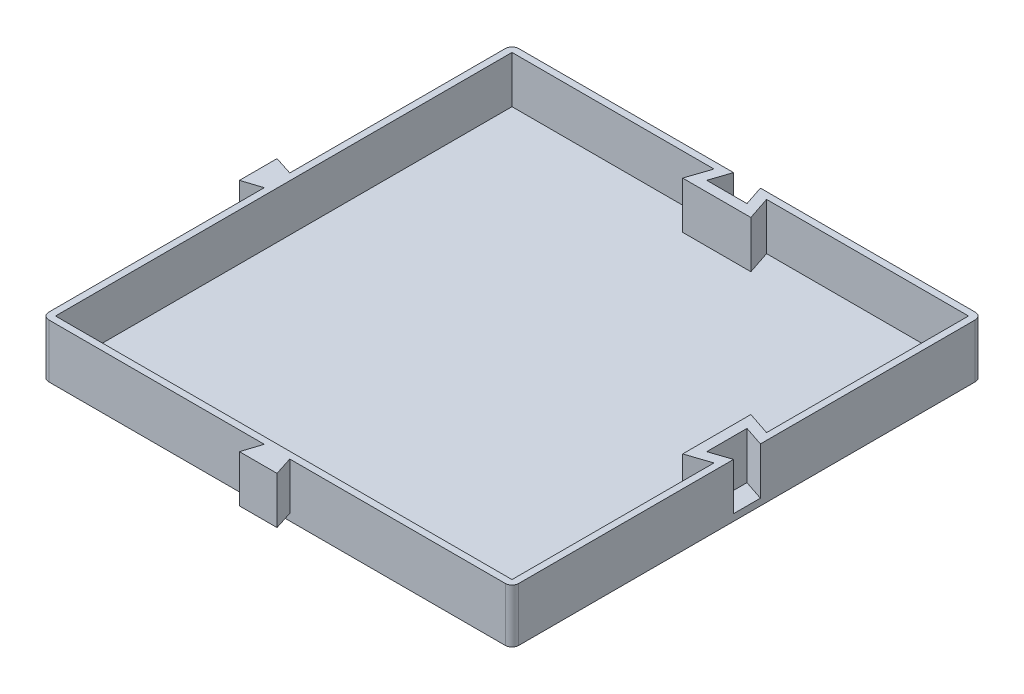
from build123d import *

# Parameters (mm, degrees)
SKETCH1_W               = 88.9
SKETCH1_H               = 88.9
BASE_DRAIN_TRAY_DEPTH   = 10.16
SKETCH2_W               = 86.36
SKETCH2_H               = 86.36
DRAIN_TRAY_CUTOUT_DEPTH = 8.89
SKETCH3_W               = 71.12
SKETCH3_H               = 71.12
BODY_DEPTH              = 50.8
SKETCH4_W               = 68.58
SKETCH4_H               = 68.58
BODY_CUTOUT_DEPTH       = 50.8
FILLET1_R               = 1.27
JOINING_SLOT_DEPTH      = 8.89
JOINING_CUTOUT_DEPTH    = 8.89
JOINING_SLOT_2_DEPTH    = 8.89
JOINING_CUTOUT_2_DEPTH  = 8.89
BOSS_EXTRUDE3_DEPTH     = 8.89
SKETCH14_W              = 71.12
SKETCH14_H              = 71.12
CUT_EXTRUDE2_DEPTH      = 50.8


with BuildPart() as part:
    # Sketch1 → Base/Drain Tray (new body)
    with BuildSketch(Plane(origin=(0, 0, 0), x_dir=(1, 0, 0), z_dir=(0, 1, 0))):
        with Locations((44.45, 44.45)):
            Rectangle(SKETCH1_W, SKETCH1_H)
    extrude(amount=BASE_DRAIN_TRAY_DEPTH)

    # Sketch2 → Drain Tray Cutout (cut)
    with BuildSketch(Plane(origin=(0, 10.16, 0), x_dir=(1, 0, 0), z_dir=(0, 1, 0))):
        with Locations((44.45, 44.45)):
            Rectangle(SKETCH2_W, SKETCH2_H)
    extrude(amount=-DRAIN_TRAY_CUTOUT_DEPTH, mode=Mode.SUBTRACT)

    # Sketch3 → Body (add)
    with BuildSketch(Plane(origin=(0, 1.27, 0), x_dir=(1, 0, 0), z_dir=(0, 1, 0))):
        with Locations((44.45, 44.45)):
            Rectangle(SKETCH3_W, SKETCH3_H)
    extrude(amount=BODY_DEPTH)

    # Sketch4 → Body Cutout (cut)
    with BuildSketch(Plane(origin=(0, 52.07, 0), x_dir=(1, 0, 0), z_dir=(0, 1, 0))):
        with Locations((44.45, 44.45)):
            Rectangle(SKETCH4_W, SKETCH4_H)
    extrude(amount=-BODY_CUTOUT_DEPTH, mode=Mode.SUBTRACT)

    # Fillet1
    fillet1_edges = [part.edges().sort_by_distance(p)[0] for p in [
        (0, 5.08, -88.9),
        (88.9, 5.08, -88.9),
        (88.9, 5.08, 0),
        (0, 5.08, 0),
    ]]
    fillet(fillet1_edges, radius=FILLET1_R)

    # Sketch7 → Joining Slot (add)
    with BuildSketch(Plane(origin=(0, 1.27, 0), x_dir=(1, 0, 0), z_dir=(0, 1, 0))):
        Polygon((40.64, 85.09), (41.486666667, 87.63), (39.478620352, 87.63), (37.996953686, 83.185), (50.903046314, 83.185), (49.421379648, 87.63), (47.413333333, 87.63), (48.26, 85.09), align=None)
    extrude(amount=JOINING_SLOT_DEPTH)

    # Sketch8 → Joining Cutout (cut)
    with BuildSketch(Plane(origin=(0, 10.16, 0), x_dir=(1, 0, 0), z_dir=(0, 1, 0))):
        Polygon((40.64, 85.09), (41.486666667, 87.63), (41.91, 88.9), (46.99, 88.9), (47.413333333, 87.63), (48.26, 85.09), align=None)
    extrude(amount=-JOINING_CUTOUT_DEPTH, mode=Mode.SUBTRACT)

    # Sketch10 → Joining Slot 2 (add)
    with BuildSketch(Plane(origin=(0, 1.27, 0), x_dir=(1, 0, 0), z_dir=(0, 1, 0))):
        Polygon((87.63, 49.421379648), (87.63, 39.478620352), (83.185, 37.996953686), (83.185, 50.903046314), align=None)
    extrude(amount=JOINING_SLOT_2_DEPTH)

    # Sketch12 → Joining Cutout 2 (cut)
    with BuildSketch(Plane(origin=(0, 1.27, 0), x_dir=(1, 0, 0), z_dir=(0, 1, 0))):
        Polygon((88.9, 41.91), (88.9, 46.99), (85.09, 48.26), (85.09, 40.64), align=None)
    extrude(amount=JOINING_CUTOUT_2_DEPTH, mode=Mode.SUBTRACT)

    # Sketch13 → Boss-Extrude3 (add)
    with BuildSketch(Plane(origin=(0, 1.27, 0), x_dir=(1, 0, 0), z_dir=(0, 1, 0))):
        Polygon((42.037, 0), (46.863, 0), (48.006, -3.556), (44.45, -3.556), (40.894, -3.556), align=None)
        Polygon((0, 46.863), (0, 42.037), (-3.556, 40.894), (-3.556, 44.45), (-3.556, 48.006), align=None)
    extrude(amount=BOSS_EXTRUDE3_DEPTH)

    # Sketch14 → Cut-Extrude2 (cut)
    with BuildSketch(Plane(origin=(0, 52.07, 0), x_dir=(1, 0, 0), z_dir=(0, 1, 0))):
        with Locations((44.45, 44.45)):
            Rectangle(SKETCH14_W, SKETCH14_H)
    extrude(amount=-CUT_EXTRUDE2_DEPTH, mode=Mode.SUBTRACT)


solid = part.part
